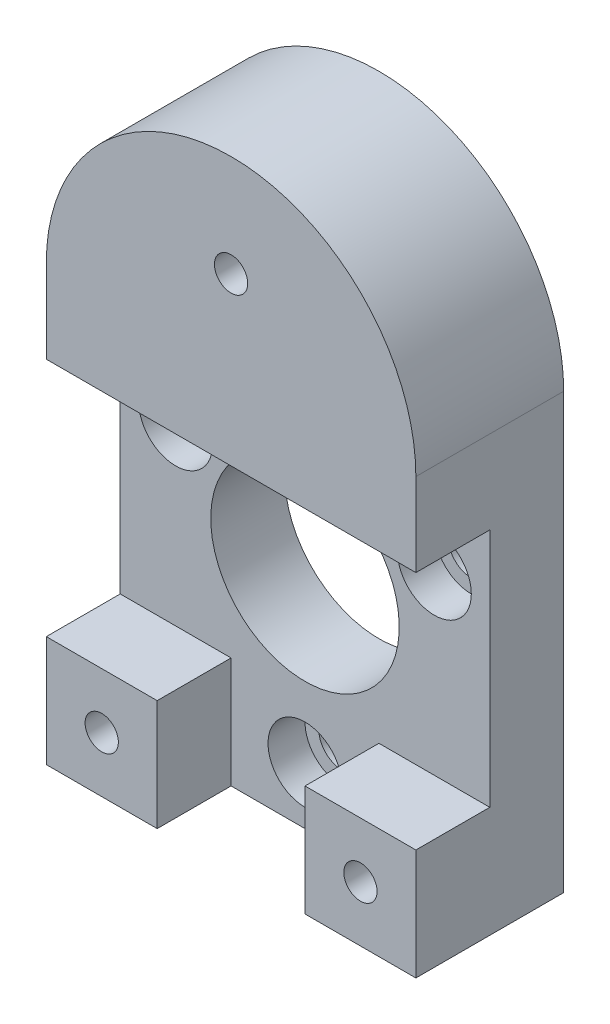
from build123d import *

# Parameters (mm, degrees)
SKETCH_1_R          = 1.25
EXTRUDE_1_DEPTH     = 4
EXTRUDE_START       = -8
EXTRUDE_2_DEPTH     = 8
EXTRUDE_START_2     = -3
EXTRUDE_3_DEPTH     = 3
CUT_EXTRUDE_START   = -4
SKETCH_1_5_R        = 2
CUT_EXTRUDE_1_DEPTH = 6
SKETCH_4_W          = 20
SKETCH_4_H          = 17.5
CUT_EXTRUDE_2_DEPTH = 4
EXTRUDE_START_3     = -4
SKETCH_5_W          = 20
SKETCH_5_H          = 6
EXTRUDE_4_DEPTH     = 8
SKETCH_6_W          = 8
SKETCH_6_H          = 6
SKETCH_6_R          = 2
SKETCH_6_R_2        = 1.25
CUT_EXTRUDE_3_DEPTH = 4
SKETCH_6_3_R        = 1.25
CUT_EXTRUDE_4_DEPTH = 26.024987512
SKETCH_6_4_R        = 2
CUT_EXTRUDE_5_DEPTH = 6
SKETCH_7_R          = 0.9
CUT_EXTRUDE_6_DEPTH = 26.024987512
SKETCH_8_W          = 20
SKETCH_8_H          = 4.5
EXTRUDE_5_DEPTH     = 4
SKETCH_9_R          = 8.5
CUT_EXTRUDE_7_DEPTH = 1
SKETCH_10_R         = 2.55
CUT_EXTRUDE_8_DEPTH = 2.6
SKETCH_11_W         = 47.635441337
SKETCH_11_H         = 39.861258083
CUT_EXTRUDE_9_DEPTH = 30.769951293


with BuildPart() as part:
    # 草图1 → 凸台-拉伸1 (new, symmetric)
    with BuildSketch(Plane.XY):
        with BuildLine():
            Line((-10, 6), (-10, -6))
            Line((-10, -6), (10, -6))
            Line((10, -6), (10, 6))
            Line((10, 6), (6.480740698, 6))
            ThreePointArc((6.480740698, 6), (5.10105555, 4.70079179), (3.467802184, 3.739565217))
            ThreePointArc((3.467802184, 3.739565217), (0, -5.1), (-3.467802184, 3.739565217))
            ThreePointArc((-3.467802184, 3.739565217), (-5.10105555, 4.70079179), (-6.480740698, 6))
            Line((-6.480740698, 6), (-10, 6))
        make_face()
        with Locations((-7, 3.5)):
            Circle(SKETCH_1_R, mode=Mode.SUBTRACT)
        with Locations((7, 3.5)):
            Circle(SKETCH_1_R, mode=Mode.SUBTRACT)
    extrude(amount=EXTRUDE_1_DEPTH, both=True)

    # 草图2 → 凸台-拉伸2 (add)
    with BuildSketch(Plane(origin=(0, 0, -4), x_dir=(-1, 0, 0), z_dir=(0, 0, -1)).offset(EXTRUDE_START)):
        with BuildLine():
            Line((6.480740698, 6), (10, 6))
            Line((10, 6), (10, 11.5))
            ThreePointArc((10, 11.5), (0, 21.5), (-10, 11.5))
            Line((-10, 11.5), (-10, 6))
            Line((-10, 6), (-6.480740698, 6))
            ThreePointArc((-6.480740698, 6), (0, 20), (6.480740698, 6))
        make_face()
    extrude(amount=EXTRUDE_2_DEPTH)

    # 草图2<4> → 凸台-拉伸3 (add)
    with BuildSketch(Plane(origin=(0, 0, -4), x_dir=(-1, 0, 0), z_dir=(0, 0, -1)).offset(EXTRUDE_START_2)):
        with BuildLine():
            Line((-6.480740698, 6), (6.480740698, 6))
            ThreePointArc((6.480740698, 6), (7.979232292, 8.570520177), (8.5, 11.5))
            ThreePointArc((8.5, 11.5), (-2.929479823, 19.479232292), (-6.480740698, 6))
        make_face()
    extrude(amount=EXTRUDE_3_DEPTH)

    # 草图1<5> → 切除-拉伸1 (cut)
    with BuildSketch(Plane.XY.offset(CUT_EXTRUDE_START)):
        with Locations((-7, 3.5)):
            Circle(SKETCH_1_5_R)
        with Locations((7, 3.5)):
            Circle(SKETCH_1_5_R)
    extrude(amount=CUT_EXTRUDE_1_DEPTH, mode=Mode.SUBTRACT)

    # 草图4 → 切除-拉伸2 (cut)
    with BuildSketch(Plane(origin=(0, 0, -4), x_dir=(-1, 0, 0), z_dir=(0, 0, -1))):
        with Locations((0, 2.75)):
            Rectangle(SKETCH_4_W, SKETCH_4_H)
    extrude(amount=-CUT_EXTRUDE_2_DEPTH, mode=Mode.SUBTRACT)

    # 草图5 → 凸台-拉伸4 (add)
    with BuildSketch(Plane(origin=(0, 0, 0), x_dir=(-1, 0, 0), z_dir=(0, 0, -1)).offset(EXTRUDE_START_3)):
        with Locations((0, -9)):
            Rectangle(SKETCH_5_W, SKETCH_5_H)
    extrude(amount=EXTRUDE_4_DEPTH)

    # 草图6 → 切除-拉伸3 (cut)
    # profile 1 of 3: a face of its own
    with BuildSketch(Plane(origin=(0, 0, -4), x_dir=(-1, 0, 0), z_dir=(0, 0, -1))):
        with Locations((0, -9)):
            Rectangle(SKETCH_6_W, SKETCH_6_H)
        with Locations((0, -9)):
            Circle(SKETCH_6_R, mode=Mode.SUBTRACT)
    # profile 2 of 3: a face of its own
    with BuildSketch(Plane(origin=(0, 0, -4), x_dir=(-1, 0, 0), z_dir=(0, 0, -1))):
        with Locations((0, -9)):
            Circle(SKETCH_6_R)
        with Locations((0, -9)):
            Circle(SKETCH_6_R_2, mode=Mode.SUBTRACT)
    # profile 3 of 3: a face of its own
    with BuildSketch(Plane(origin=(0, 0, -4), x_dir=(-1, 0, 0), z_dir=(0, 0, -1))):
        with Locations((0, -9)):
            Circle(SKETCH_6_R_2)
    extrude(amount=-CUT_EXTRUDE_3_DEPTH, mode=Mode.SUBTRACT)

    # 草图6<3> → 切除-拉伸4 (cut, through all)
    with BuildSketch(Plane(origin=(0, 0, -4), x_dir=(-1, 0, 0), z_dir=(0, 0, -1))):
        with Locations((0, -9)):
            Circle(SKETCH_6_3_R)
    extrude(amount=-CUT_EXTRUDE_4_DEPTH, mode=Mode.SUBTRACT)

    # 草图6<4> → 切除-拉伸5 (cut)
    with BuildSketch(Plane(origin=(0, 0, -4), x_dir=(-1, 0, 0), z_dir=(0, 0, -1))):
        with Locations(Location((0, -9, 0), (0, 0, 180))):
            Circle(SKETCH_6_4_R)
    extrude(amount=-CUT_EXTRUDE_5_DEPTH, mode=Mode.SUBTRACT)

    # 草图7 → 切除-拉伸6 (cut, through all)
    with BuildSketch(Plane(origin=(0, 0, -4), x_dir=(-1, 0, 0), z_dir=(0, 0, -1))):
        with Locations((7, -9)):
            Circle(SKETCH_7_R)
        with Locations((-7, -9)):
            Circle(SKETCH_7_R)
        with Locations((0, 16)):
            Circle(SKETCH_7_R)
    extrude(amount=-CUT_EXTRUDE_6_DEPTH, mode=Mode.SUBTRACT)

    # 草图8 → 凸台-拉伸5 (add)
    with BuildSketch(Plane(origin=(0, 0, 0), x_dir=(-1, 0, 0), z_dir=(0, 0, -1))):
        with Locations((0, 9.25)):
            Rectangle(SKETCH_8_W, SKETCH_8_H)
    extrude(amount=EXTRUDE_5_DEPTH)

    # 草图9 → 切除-拉伸7 (cut)
    with BuildSketch(Plane.XY):
        with Locations((0, 11.5)):
            Circle(SKETCH_9_R)
    extrude(amount=-CUT_EXTRUDE_7_DEPTH, mode=Mode.SUBTRACT)

    # 草图10 → 切除-拉伸8 (cut)
    with BuildSketch(Plane.XY.offset(-1)):
        with Locations((0, 11.5)):
            Circle(SKETCH_10_R)
    extrude(amount=-CUT_EXTRUDE_8_DEPTH, mode=Mode.SUBTRACT)


with BuildPart() as body_2:
    # 镜向1: mirrored copy
    add(part.part.mirror(Plane.XY.offset(14)))


with BuildPart() as part_1:
    add(part.part)

    # 草图11 → 切除-拉伸9 (cut, through all)
    with BuildSketch(Plane.XY.offset(14)):
        with Locations((-3.268127992, 5.220412363)):
            Rectangle(SKETCH_11_W, SKETCH_11_H)
    extrude(amount=-CUT_EXTRUDE_9_DEPTH, mode=Mode.SUBTRACT)


solid = body_2.part
